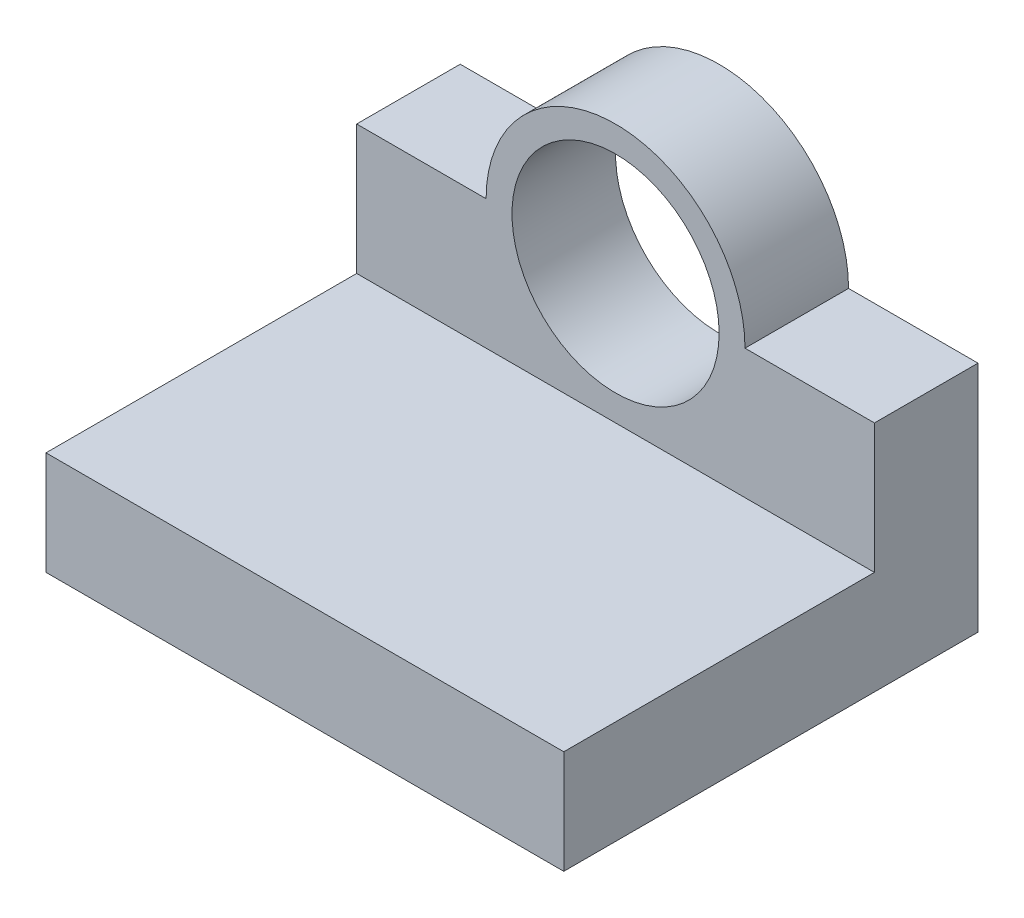
from build123d import *

# Parameters (mm, degrees)
SKETCH1_R           = 20
BOSS_EXTRUDE1_DEPTH = 20
SKETCH2_W           = 100
SKETCH2_H           = 20
BOSS_EXTRUDE2_DEPTH = 60


with BuildPart() as part:
    # Sketch1 → Boss-Extrude1 (new body)
    with BuildSketch(Plane.XY):
        with BuildLine():
            Line((-50, 22.5), (-25, 22.5))
            ThreePointArc((-25, 22.5), (0, 47.5), (25, 22.5))
            Line((25, 22.5), (50, 22.5))
            Line((50, 22.5), (50, -22.5))
            Line((50, -22.5), (-50, -22.5))
            Line((-50, -22.5), (-50, 22.5))
        make_face()
        with Locations((0, 22.5)):
            Circle(SKETCH1_R, mode=Mode.SUBTRACT)
    extrude(amount=BOSS_EXTRUDE1_DEPTH)

    # Sketch2 → Boss-Extrude2 (add)
    with BuildSketch(Plane.XY.offset(20)):
        with Locations((0, -12.5)):
            Rectangle(SKETCH2_W, SKETCH2_H)
    extrude(amount=BOSS_EXTRUDE2_DEPTH)


solid = part.part
